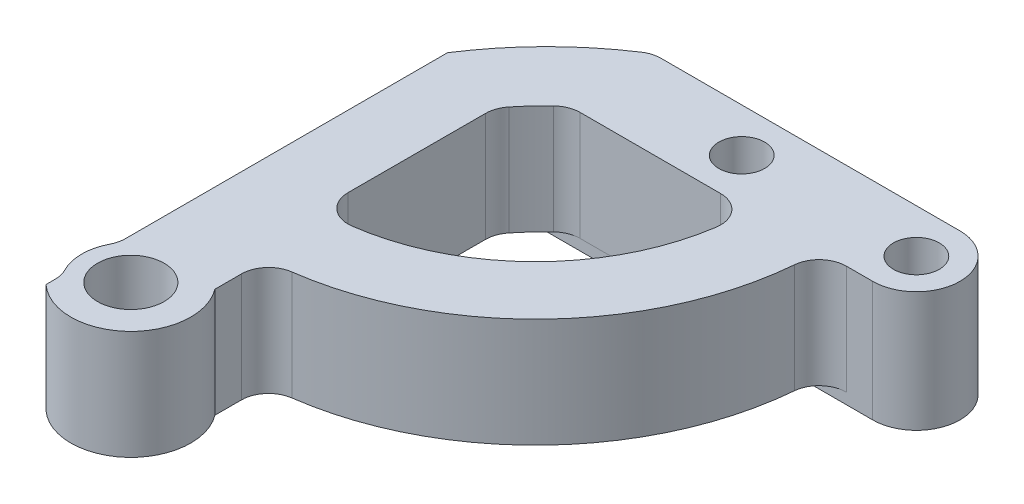
from build123d import *

# Parameters (mm, degrees)
SKETCH1_R           = 2.1
SKETCH1_R_2         = 3.05
BOSS_EXTRUDE1_DEPTH = 11
FILLET1_R           = 2.5
SKETCH3_W           = 62.051099289
SKETCH3_H           = 53.114404745
CUT_EXTRUDE2_DEPTH  = 1


with BuildPart() as part:
    # Sketch1 → Boss-Extrude1 (new body)
    with BuildSketch(Plane(origin=(0, 0, 0), x_dir=(1, 0, 0), z_dir=(0, 1, 0))):
        with BuildLine():
            Line((-141.618040472, -49.123128832), (-141.618040472, -47.605232566))
            ThreePointArc((-141.618040472, -47.605232566), (-142.400064406, -45.070147956), (-141.618040472, -42.535063347))
            Line((-141.618040472, -42.535063347), (-141.618040472, -12.337528489))
            ThreePointArc((-141.618040472, -12.337528489), (-137.391041816, -7.146645093), (-132.135757115, -2.999987309))
            Line((-132.135757115, -2.999987309), (-104.000008179, -2.999987309))
            ThreePointArc((-104.000008179, -2.999987309), (-100.000008179, -6.999987309), (-104.000008179, -10.999987309))
            Line((-104.000008179, -10.999987309), (-108.800450344, -10.999987309))
            ThreePointArc((-108.800450344, -10.999987309), (-115.958519489, -28.95773414), (-133.507163129, -37.067218191))
            Line((-133.507163129, -37.067218191), (-133.507163129, -41.760704141))
            ThreePointArc((-133.507163129, -41.760704141), (-134.203416554, -49.142591284), (-141.618040472, -49.123128832))
        make_face()
        with Locations(Location((-104.000008179, -6.999987309, 0), (0, 0, 270))):
            Circle(SKETCH1_R, mode=Mode.SUBTRACT)
        with Locations(Location((-120, -7, 0), (0, 0, 270))):
            Circle(SKETCH1_R, mode=Mode.SUBTRACT)
        with Locations(Location((-137.900064406, -45.070147956, 0), (0, 0, 270))):
            Circle(SKETCH1_R_2, mode=Mode.SUBTRACT)
        with BuildLine():
            Line((-115.253720782, -11.000000067), (-131.784308422, -11.000000067))
            ThreePointArc((-131.784308422, -11.000000067), (-133.511366358, -12.688858412), (-135.059388776, -14.543204177))
            Line((-135.059388776, -14.543204177), (-135.07674933, -30.650657269))
            ThreePointArc((-135.07674933, -30.650657269), (-121.070295096, -24.956188563), (-115.253720782, -11.000000067))
        make_face(mode=Mode.SUBTRACT)
    extrude(amount=BOSS_EXTRUDE1_DEPTH)

    # Fillet1
    fillet1_edges = [part.edges().sort_by_distance(p)[0] for p in [
        (-141.618040472, 5.5, 47.605232566),
        (-141.618040472, 5.5, 42.535063347),
        (-132.135757115, 5.5, 2.999987309),
        (-108.800450344, 5.5, 10.999987309),
        (-133.507163129, 5.5, 37.067218191),
        (-135.07674933, 5.5, 30.650657269),
        (-115.253720782, 5.5, 11.000000067),
        (-131.784308422, 5.5, 11.000000067),
        (-135.059388776, 5.5, 14.543204177),
    ]]
    fillet(fillet1_edges, radius=FILLET1_R)

    # Sketch3 → Cut-Extrude2 (cut)
    with BuildSketch(Plane.XZ):
        with Locations((-120.556091454, 37.557189682)):
            Rectangle(SKETCH3_W, SKETCH3_H)
    extrude(amount=-CUT_EXTRUDE2_DEPTH, mode=Mode.SUBTRACT)


solid = part.part
